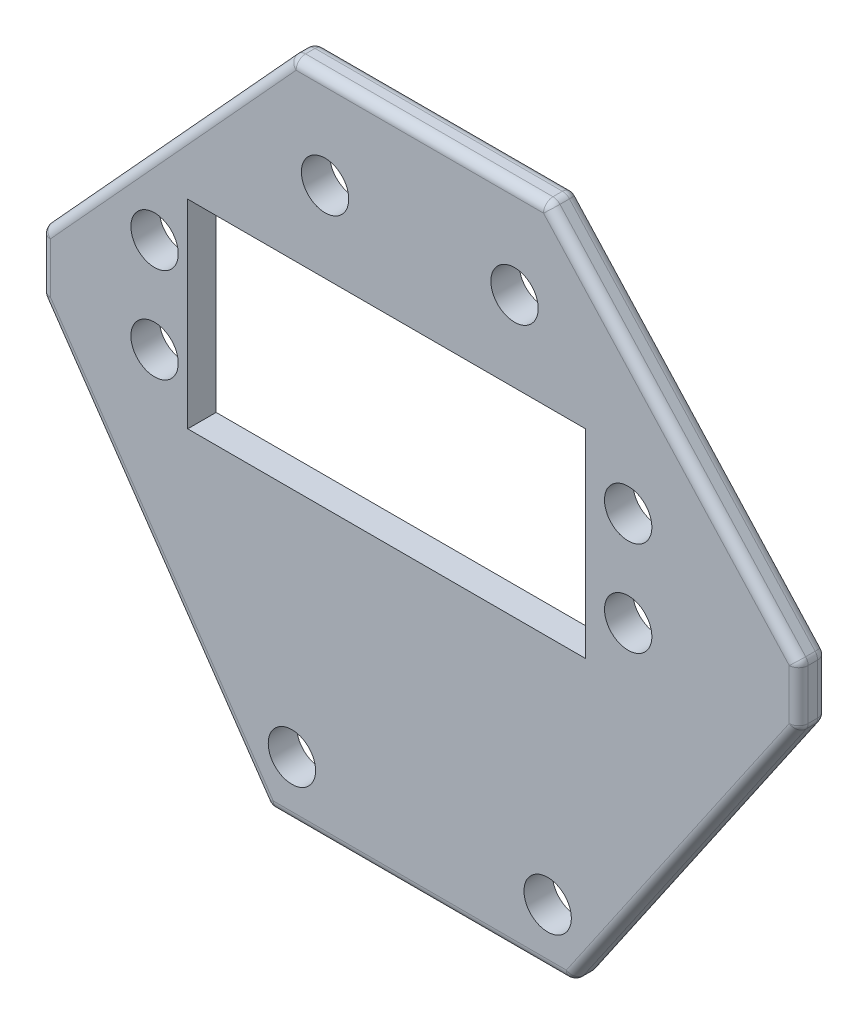
from build123d import *

# Parameters (mm, degrees)
BOSS_EXTRUDE1_DEPTH = 3
SKETCH2_R           = 2.5
CUT_EXTRUDE1_DEPTH  = 10
CUT_EXTRUDE2_DEPTH  = 10
SKETCH5_R           = 2.5
CUT_EXTRUDE3_DEPTH  = 10
FILLET1_R           = 1


with BuildPart() as part:
    # Sketch1 → Boss-Extrude1 (new body)
    with BuildSketch(Plane.XY):
        Polygon((-13.5, 29), (-40, 0), (-40, -6), (-16, -41), (16, -41), (40, -6), (40, 0), (13.5, 29), align=None)
    extrude(amount=BOSS_EXTRUDE1_DEPTH)

    # Sketch2 → Cut-Extrude1 (cut)
    with BuildSketch(Plane(origin=(0, 0, 0), x_dir=(-1, 0, 0), z_dir=(0, 0, -1))):
        with Locations((-10, 19)):
            Circle(SKETCH2_R)
        with Locations((10, 19)):
            Circle(SKETCH2_R)
        with Locations((-13.5, -35)):
            Circle(SKETCH2_R)
        with Locations((13.5, -35)):
            Circle(SKETCH2_R)
    extrude(amount=-CUT_EXTRUDE1_DEPTH, mode=Mode.SUBTRACT)

    # Sketch3 → Cut-Extrude2 (cut)
    with BuildSketch(Plane(origin=(0, 0, 0), x_dir=(-1, 0, 0), z_dir=(0, 0, -1))):
        Polygon((24.5, 0), (24.5, 10.5), (-17.5, 10.5), (-17.5, -10.5), (24.5, -10.5), align=None)
    extrude(amount=-CUT_EXTRUDE2_DEPTH, mode=Mode.SUBTRACT)

    # Sketch5 → Cut-Extrude3 (cut)
    with BuildSketch(Plane.XY.offset(3)):
        with Locations((-28, -5)):
            Circle(SKETCH5_R)
        with Locations((-28, 5)):
            Circle(SKETCH5_R)
        with Locations((22, -5)):
            Circle(SKETCH5_R)
        with Locations((22, 5)):
            Circle(SKETCH5_R)
    extrude(amount=-CUT_EXTRUDE3_DEPTH, mode=Mode.SUBTRACT)

    # Fillet1
    fillet1_edges = [part.edges().sort_by_distance(p)[0] for p in [
        (-40, -3, 3),
        (-26.75, 14.5, 0),
        (0, 29, 0),
        (-28, -23.5, 3),
        (13.5, 29, 1.5),
        (40, 0, 1.5),
        (40, -6, 1.5),
        (16, -41, 1.5),
        (-16, -41, 1.5),
        (-40, -6, 1.5),
        (-40, 0, 1.5),
        (-13.5, 29, 1.5),
        (0, -41, 3),
        (28, -23.5, 3),
        (40, -3, 3),
        (26.75, 14.5, 3),
        (0, 29, 3),
        (-26.75, 14.5, 3),
        (26.75, 14.5, 0),
        (40, -3, 0),
        (28, -23.5, 0),
        (0, -41, 0),
        (-28, -23.5, 0),
        (-40, -3, 0),
    ]]
    fillet(fillet1_edges, radius=FILLET1_R)


solid = part.part
